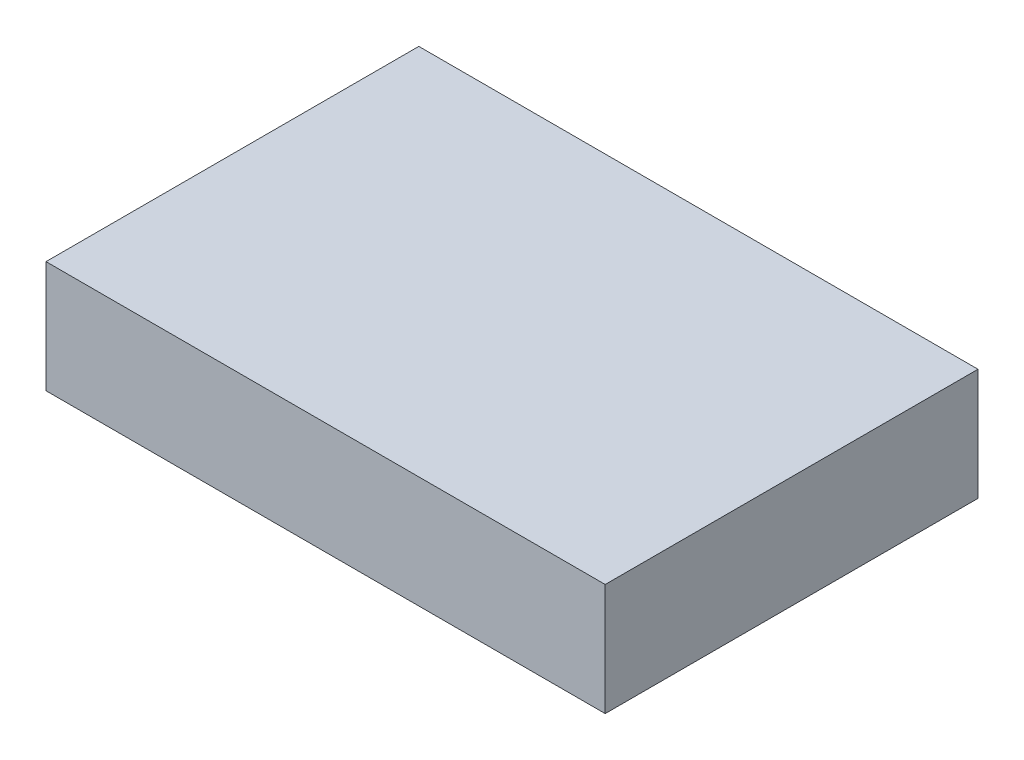
from build123d import *

# Parameters (mm, degrees)
ESBO_O1_W                = 60
ESBO_O1_H                = 40
RESSALTO_EXTRUS_O1_DEPTH = 12


with BuildPart() as part:
    # Esboço1 → Ressalto-extrusão1 (new body)
    with BuildSketch(Plane(origin=(0, 0, 0), x_dir=(1, 0, 0), z_dir=(0, 1, 0))):
        Rectangle(ESBO_O1_W, ESBO_O1_H)
    extrude(amount=RESSALTO_EXTRUS_O1_DEPTH)


solid = part.part
